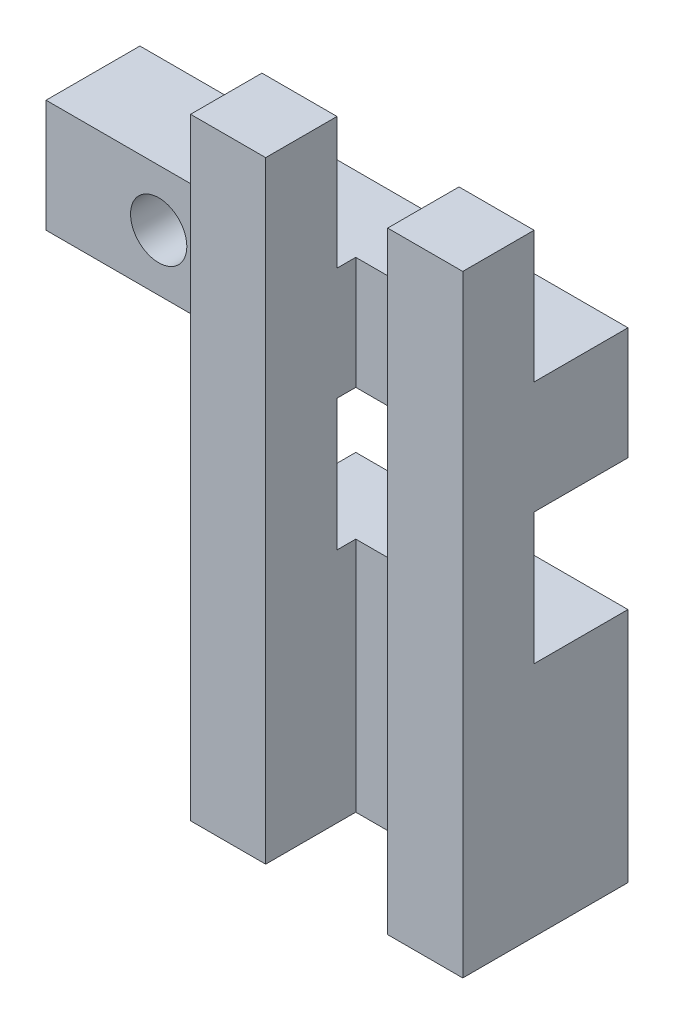
from build123d import *

# Parameters (mm, degrees)
SKETCH_1_W          = 26
SKETCH_1_H          = 6
SKETCH_1_R          = 1.5
EXTRUDE_1_DEPTH     = 5
SKETCH_2_W          = 4
SKETCH_2_H          = 32.6
EXTRUDE_2_DEPTH     = 3.8
SKETCH_3_W          = 6.5
SKETCH_3_H          = 6.5
CUT_EXTRUDE_1_DEPTH = 1
SKETCH_4_W          = 14.5
SKETCH_4_H          = 12.6
EXTRUDE_3_DEPTH     = 5
SKETCH_5_W          = 6.5
SKETCH_5_H          = 12.6
CUT_EXTRUDE_2_DEPTH = 1


with BuildPart() as part:
    # 草图1 → 凸台-拉伸1 (new body)
    with BuildSketch(Plane.XY):
        with Locations((13, -3)):
            Rectangle(SKETCH_1_W, SKETCH_1_H)
        with Locations((6, -3)):
            Circle(SKETCH_1_R, mode=Mode.SUBTRACT)
    extrude(amount=EXTRUDE_1_DEPTH)

    # 草图2 → 凸台-拉伸2 (add)
    with BuildSketch(Plane.XY.offset(5)):
        with Locations((24, -9.3)):
            Rectangle(SKETCH_2_W, SKETCH_2_H)
        with Locations((13.5, -9.3)):
            Rectangle(SKETCH_2_W, SKETCH_2_H)
    extrude(amount=EXTRUDE_2_DEPTH)

    # 草图3 → 切除-拉伸1 (cut)
    with BuildSketch(Plane.XY.offset(5)):
        with Locations((18.75, -2.75)):
            Rectangle(SKETCH_3_W, SKETCH_3_H)
    extrude(amount=-CUT_EXTRUDE_1_DEPTH, mode=Mode.SUBTRACT)

    # 草图4 → 凸台-拉伸3 (add)
    with BuildSketch(Plane(origin=(0, 0, 5), x_dir=(-1, 0, 0), z_dir=(0, 0, -1))):
        with Locations((-18.75, -19.3)):
            Rectangle(SKETCH_4_W, SKETCH_4_H)
    extrude(amount=EXTRUDE_3_DEPTH)

    # 草图5 → 切除-拉伸2 (cut)
    with BuildSketch(Plane.XY.offset(5)):
        with Locations((18.75, -19.3)):
            Rectangle(SKETCH_5_W, SKETCH_5_H)
    extrude(amount=-CUT_EXTRUDE_2_DEPTH, mode=Mode.SUBTRACT)


solid = part.part
